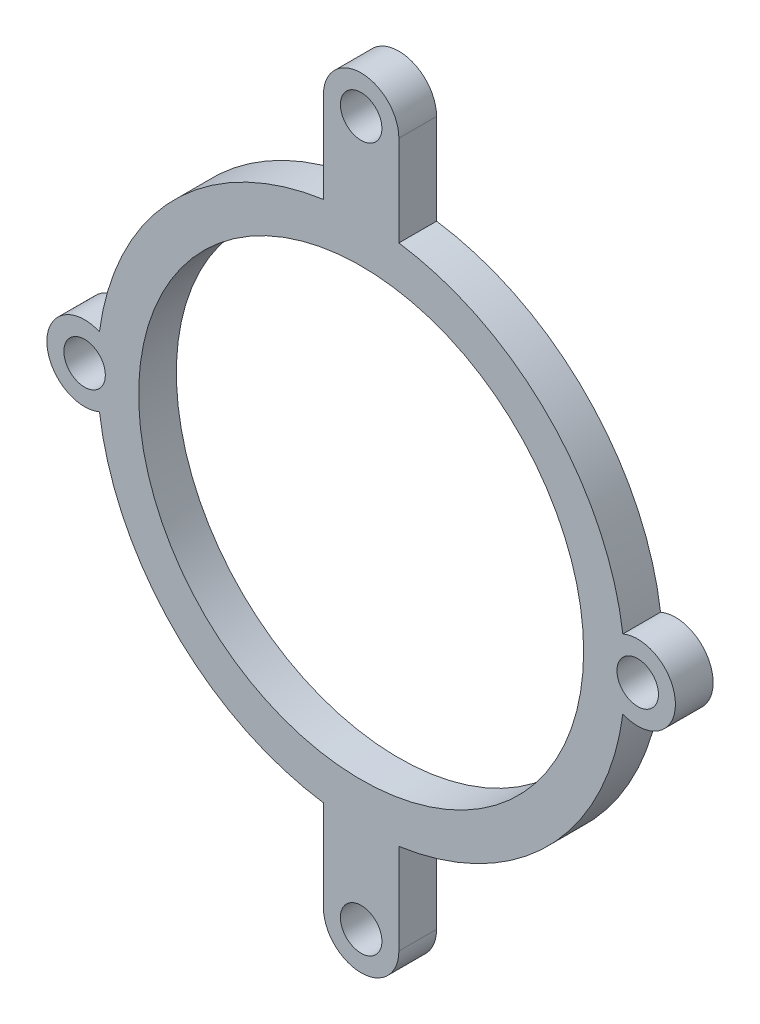
from build123d import *

# Parameters (mm, degrees)
SKETCH_1_R      = 1.65
SKETCH_1_R_2    = 17.7
EXTRUDE_1_DEPTH = 3


with BuildPart() as part:
    # 草图1 → 凸台-拉伸1 (new body)
    with BuildSketch(Plane.XY):
        with BuildLine():
            Line((3, 20.784609691), (3, 28))
            ThreePointArc((3, 28), (0, 31), (-3, 28))
            Line((-3, 28), (-3, 20.784609691))
            ThreePointArc((-3, 20.784609691), (-14.935576159, 14.762403761), (-20.818181818, 2.757409252))
            ThreePointArc((-20.818181818, 2.757409252), (-25, 0), (-20.818181818, -2.757409252))
            ThreePointArc((-20.818181818, -2.757409252), (-14.935576159, -14.762403761), (-3, -20.784609691))
            Line((-3, -20.784609691), (-3, -28))
            ThreePointArc((-3, -28), (0, -31), (3, -28))
            Line((3, -28), (3, -20.784609691))
            ThreePointArc((3, -20.784609691), (14.935576159, -14.762403761), (20.818181818, -2.757409252))
            ThreePointArc((20.818181818, -2.757409252), (25, 0), (20.818181818, 2.757409252))
            ThreePointArc((20.818181818, 2.757409252), (14.935576159, 14.762403761), (3, 20.784609691))
        make_face()
        with Locations((0, 28)):
            Circle(SKETCH_1_R, mode=Mode.SUBTRACT)
        Circle(SKETCH_1_R_2, mode=Mode.SUBTRACT)
        with Locations((-22, 0)):
            Circle(SKETCH_1_R, mode=Mode.SUBTRACT)
        with Locations((22, 0)):
            Circle(SKETCH_1_R, mode=Mode.SUBTRACT)
        with Locations((0, -28)):
            Circle(SKETCH_1_R, mode=Mode.SUBTRACT)
    extrude(amount=EXTRUDE_1_DEPTH)


solid = part.part
